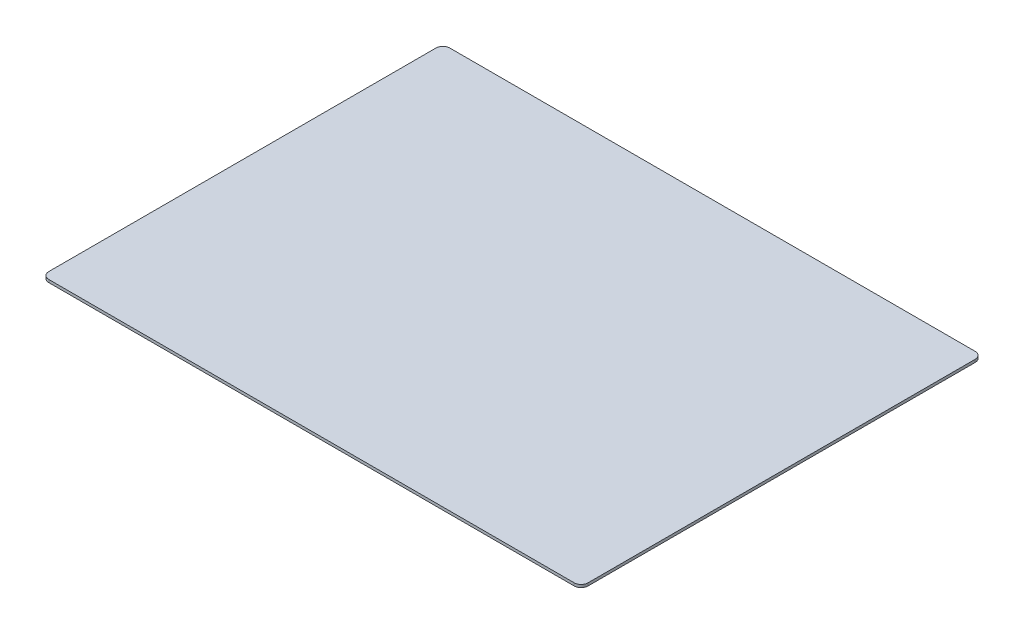
from build123d import *

# Parameters (mm, degrees)
SKETCH_1_W      = 390
SKETCH_1_H      = 290
EXTRUDE_1_DEPTH = 2
FILLET_1_R      = 5


with BuildPart() as part:
    # 스케치1 → 보스-돌출1 (new body)
    with BuildSketch(Plane(origin=(0, 0, 0), x_dir=(1, 0, 0), z_dir=(0, 1, 0))):
        Rectangle(SKETCH_1_W, SKETCH_1_H)
    extrude(amount=EXTRUDE_1_DEPTH)

    # 필렛1
    fillet_1_edges = [part.edges().sort_by_distance(p)[0] for p in [
        (195, 1, 145),
        (-195, 1, 145),
        (-195, 1, -145),
        (195, 1, -145),
    ]]
    fillet(fillet_1_edges, radius=FILLET_1_R)


solid = part.part
